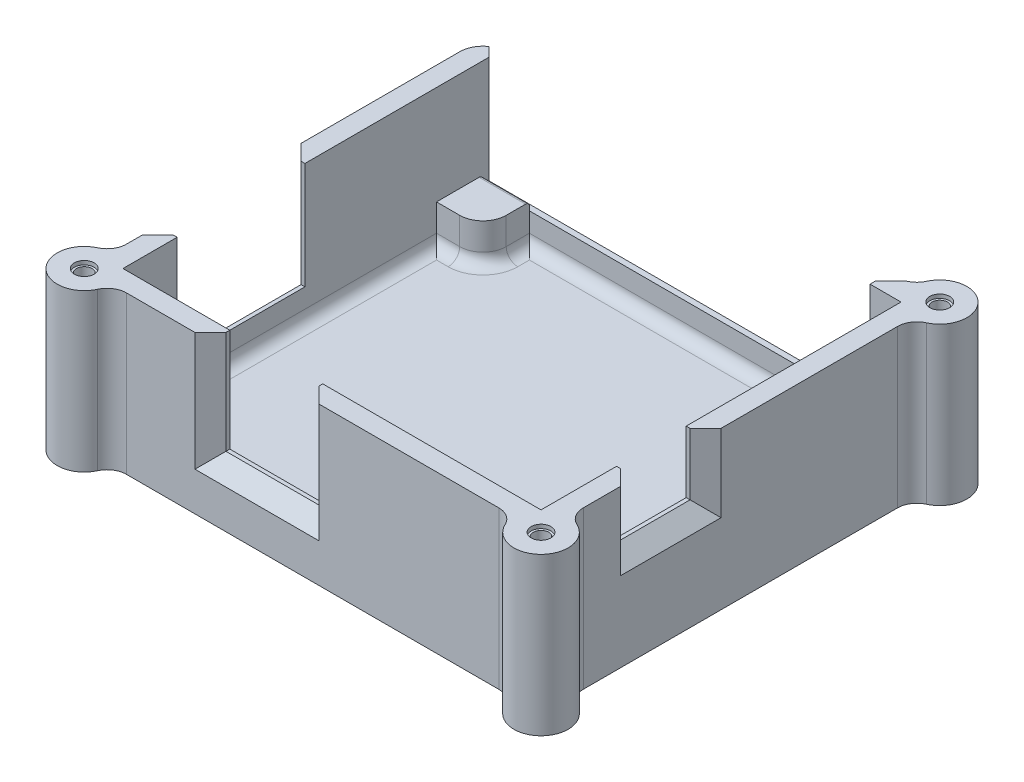
from build123d import *

# Parameters (mm, degrees)
SKETCH1_W               = 118
SKETCH1_H               = 103
SKETCH1_W_2             = 108
SKETCH1_H_2             = 93
SKETCH1_W_3             = 106
SKETCH1_H_3             = 91
BOSS_EXTRUDE1_DEPTH     = 5
SKETCH2_W               = 118
SKETCH2_H               = 103
SKETCH2_W_2             = 108
SKETCH2_H_2             = 93
BOSS_EXTRUDE2_DEPTH     = 35.6
SKETCH3_W               = 12
SKETCH3_H               = 12
BOSS_EXTRUDE3_DEPTH     = 10
MIRROR5_COPY_1_SKETCH_W = 12
MIRROR5_COPY_1_SKETCH_H = 12
MIRROR5_COPY_1_DEPTH    = 10
SKETCH4_R               = 2
CUT_EXTRUDE1_DEPTH      = 6
SKETCH4_3_R             = 2.525
CUT_EXTRUDE2_DEPTH      = 1
SKETCH6_W               = 100
SKETCH6_H               = 27.6
CUT_EXTRUDE3_DEPTH      = 122.381052887
SKETCH7_W               = 33
SKETCH7_H               = 27.6
CUT_EXTRUDE4_DEPTH      = 131.650717564
SKETCH8_W               = 24
SKETCH8_H               = 26.6
CUT_EXTRUDE5_DEPTH      = 122.381052887
CHAMFER1_SIZE           = 3.5
SKETCH10_W              = 18
SKETCH10_H              = 16
CUT_EXTRUDE7_DEPTH      = 131.650717564
SKETCH11_R              = 7
BOSS_EXTRUDE4_DEPTH     = 40.6
FILLET1_R               = 6
CHAMFER2_SIZE           = 4
CHAMFER3_SIZE           = 4
FILLET2_R               = 3
CHAMFER4_SIZE           = 4
FILLET7_R               = 5
FILLET8_R               = 1
FILLET9_R               = 6
SKETCH12_R              = 2
CUT_EXTRUDE9_DEPTH      = 10
SKETCH12_3_R            = 2.55
CUT_EXTRUDE10_DEPTH     = 1


with BuildPart() as part:
    # Sketch1 → Boss-Extrude1 (new body)
    # profile 1 of 3: a face of its own
    with BuildSketch(Plane(origin=(0, 0, 0), x_dir=(1, 0, 0), z_dir=(0, 1, 0))):
        Rectangle(SKETCH1_W, SKETCH1_H)
        Rectangle(SKETCH1_W_2, SKETCH1_H_2, mode=Mode.SUBTRACT)
    # profile 2 of 3: a face of its own
    with BuildSketch(Plane(origin=(0, 0, 0), x_dir=(1, 0, 0), z_dir=(0, 1, 0))):
        Rectangle(SKETCH1_W_2, SKETCH1_H_2)
        Rectangle(SKETCH1_W_3, SKETCH1_H_3, mode=Mode.SUBTRACT)
    # profile 3 of 3: a face of its own
    with BuildSketch(Plane(origin=(0, 0, 0), x_dir=(1, 0, 0), z_dir=(0, 1, 0))):
        Rectangle(SKETCH1_W_3, SKETCH1_H_3)
    extrude(amount=BOSS_EXTRUDE1_DEPTH)

    # Sketch2 → Boss-Extrude2 (add)
    with BuildSketch(Plane(origin=(0, 5, 0), x_dir=(1, 0, 0), z_dir=(0, 1, 0))):
        Rectangle(SKETCH2_W, SKETCH2_H)
        Rectangle(SKETCH2_W_2, SKETCH2_H_2, mode=Mode.SUBTRACT)
    extrude(amount=BOSS_EXTRUDE2_DEPTH)

    # Sketch3 → Boss-Extrude3 (add)
    with BuildSketch(Plane(origin=(0, 5, 0), x_dir=(1, 0, 0), z_dir=(0, 1, 0))):
        with Locations((48, -40.5)):
            Rectangle(SKETCH3_W, SKETCH3_H)
    boss_extrude3 = extrude(amount=BOSS_EXTRUDE3_DEPTH)

    # Mirror4: Boss-Extrude3 across plane
    add(boss_extrude3.mirror(Plane(origin=(0, 0, 0), x_dir=(0, 0, 1), z_dir=(1, 0, 0))))

    # Mirror5: Boss-Extrude3 across plane
    add(boss_extrude3.mirror(Plane.XY))

    # Mirror5 copy 1 sketch → Mirror5 copy 1 (add)
    with BuildSketch(Plane(origin=(0, 5, 0), x_dir=(-1, 0, 0), z_dir=(0, 1, 0))):
        with Locations((48, -40.5)):
            Rectangle(MIRROR5_COPY_1_SKETCH_W, MIRROR5_COPY_1_SKETCH_H)
    extrude(amount=MIRROR5_COPY_1_DEPTH)

    # Sketch4 → Cut-Extrude1 (cut)
    with BuildSketch(Plane(origin=(0, 15, 0), x_dir=(1, 0, 0), z_dir=(0, 1, 0))):
        with Locations(Location((48, -40.5, 0), (0, 0, 270))):
            Circle(SKETCH4_R)
    cut_extrude1 = extrude(amount=-CUT_EXTRUDE1_DEPTH, mode=Mode.SUBTRACT)

    # Sketch4<3> → Cut-Extrude2 (cut)
    with BuildSketch(Plane(origin=(0, 15, 0), x_dir=(1, 0, 0), z_dir=(0, 1, 0))):
        with Locations(Location((48, -40.5, 0), (0, 0, 270))):
            Circle(SKETCH4_3_R)
    cut_extrude2 = extrude(amount=-CUT_EXTRUDE2_DEPTH, mode=Mode.SUBTRACT)

    # Mirror2: Boss-Extrude3, Cut-Extrude1, Cut-Extrude2 across plane
    add(boss_extrude3.mirror(Plane.XY))
    add(cut_extrude1.mirror(Plane.XY), mode=Mode.SUBTRACT)
    add(cut_extrude2.mirror(Plane.XY), mode=Mode.SUBTRACT)

    # Mirror2 at the second plane: Boss-Extrude3, Cut-Extrude1, Cut-Extrude2 across plane
    add(boss_extrude3.mirror(Plane(origin=(0, 0, 0), x_dir=(0, 0, 1), z_dir=(1, 0, 0))))
    add(cut_extrude1.mirror(Plane(origin=(0, 0, 0), x_dir=(0, 0, 1), z_dir=(1, 0, 0))), mode=Mode.SUBTRACT)
    add(cut_extrude2.mirror(Plane(origin=(0, 0, 0), x_dir=(0, 0, 1), z_dir=(1, 0, 0))), mode=Mode.SUBTRACT)

    # Sketch6 → Cut-Extrude3 (cut, through all)
    with BuildSketch(Plane.XY.offset(-46.5)):
        with Locations((-4, 26.8)):
            Rectangle(SKETCH6_W, SKETCH6_H)
    extrude(amount=-CUT_EXTRUDE3_DEPTH, mode=Mode.SUBTRACT)

    # Sketch7 → Cut-Extrude4 (cut, through all)
    with BuildSketch(Plane(origin=(-54, 0, 0), x_dir=(0, 0, -1), z_dir=(1, 0, 0))):
        with Locations((-16, 26.8)):
            Rectangle(SKETCH7_W, SKETCH7_H)
    extrude(amount=-CUT_EXTRUDE4_DEPTH, mode=Mode.SUBTRACT)

    # Sketch8 → Cut-Extrude5 (cut, through all)
    with BuildSketch(Plane(origin=(0, 0, 46.5), x_dir=(-1, 0, 0), z_dir=(0, 0, -1))):
        with Locations((14.4, 27.3)):
            Rectangle(SKETCH8_W, SKETCH8_H)
    extrude(amount=-CUT_EXTRUDE5_DEPTH, mode=Mode.SUBTRACT)

    # Chamfer1
    chamfer1_edges = [part.edges().sort_by_distance(p)[0] for p in [
        (-54, 26.8, -51.5),
        (46, 26.8, -51.5),
        (-4, 13, -51.5),
    ]]
    chamfer(chamfer1_edges, length=CHAMFER1_SIZE)

    # Sketch10 → Cut-Extrude7 (cut, through all)
    with BuildSketch(Plane.ZY.offset(-54)):
        with Locations((18, 32.6)):
            Rectangle(SKETCH10_W, SKETCH10_H)
    extrude(amount=-CUT_EXTRUDE7_DEPTH, mode=Mode.SUBTRACT)

    # Sketch11 → Boss-Extrude4 (add)
    with BuildSketch(Plane(origin=(0, 0, 0), x_dir=(1, 0, 0), z_dir=(0, 1, 0))):
        with Locations((59, -51.5)):
            Circle(SKETCH11_R)
        with Locations((59, 51.5)):
            Circle(SKETCH11_R)
        with Locations((-59, -51.5)):
            Circle(SKETCH11_R)
    extrude(amount=BOSS_EXTRUDE4_DEPTH)

    # Fillet1
    fillet1_edges = [part.edges().sort_by_distance(p)[0] for p in [
        (42, 10, 34.5),
        (-42, 10, 34.5),
        (-42, 10, -34.5),
        (42, 10, -34.5),
    ]]
    fillet(fillet1_edges, radius=FILLET1_R)

    # Chamfer2
    chamfer2_edges = [part.edges().sort_by_distance(p)[0] for p in [
        (-59, 26.8, 32.5),
        (-59, 26.8, -0.5),
        (-59, 13, 16),
    ]]
    chamfer(chamfer2_edges, length=CHAMFER2_SIZE)

    # Chamfer3
    chamfer3_edges = [part.edges().sort_by_distance(p)[0] for p in [
        (-26.4, 27.3, 51.5),
        (-14.4, 14, 51.5),
        (-2.4, 27.3, 51.5),
    ]]
    chamfer(chamfer3_edges, length=CHAMFER3_SIZE)

    # Fillet2
    fillet2_edges = [part.edges().sort_by_distance(p)[0] for p in [
        (-42, 5, 43.5),
        (-42, 5, -43.5),
        (42, 5, -43.5),
        (42, 5, 43.5),
        (-43.757359313, 5, 36.257359313),
        (-43.757359313, 5, -36.257359313),
        (43.757359313, 5, -36.257359313),
        (43.757359313, 5, 36.257359313),
        (54, 5, 0),
        (51, 5, 34.5),
        (0, 5, 46.5),
        (-51, 5, 34.5),
        (-54, 5, 0),
        (-51, 5, -34.5),
        (0, 5, -46.5),
        (51, 5, -34.5),
    ]]
    fillet(fillet2_edges, radius=FILLET2_R)

    # Chamfer4
    chamfer4_edges = [part.edges().sort_by_distance(p)[0] for p in [
        (59, 32.6, 9),
        (59, 32.6, 27),
        (59, 24.6, 18),
    ]]
    chamfer(chamfer4_edges, length=CHAMFER4_SIZE)

    # Fillet7
    fillet7_edges = [part.edges().sort_by_distance(p)[0] for p in [
        (52, 20.3, -51.5),
        (59, 20.3, -44.5),
        (59, 20.3, 44.5),
        (52, 20.3, 51.5),
        (-52, 20.3, 51.5),
        (-59, 20.3, 44.5),
    ]]
    fillet(fillet7_edges, radius=FILLET7_R)

    # Fillet8
    fillet8_edges = [part.edges().sort_by_distance(p)[0] for p in [
        (-48, 15, -46.5),
        (44, 15, -46.5),
    ]]
    fillet(fillet8_edges, radius=FILLET8_R)

    # Fillet9
    fillet9_edges = [part.edges().sort_by_distance(p)[0] for p in [
        (-59, 20.3, -51.5),
    ]]
    fillet(fillet9_edges, radius=FILLET9_R)

    # Sketch12 → Cut-Extrude9 (cut)
    with BuildSketch(Plane(origin=(0, 40.6, 0), x_dir=(1, 0, 0), z_dir=(0, 1, 0))):
        with Locations(Location((59, -51.5, 0), (0, 0, 270))):
            Circle(SKETCH12_R)
    cut_extrude9 = extrude(amount=-CUT_EXTRUDE9_DEPTH, mode=Mode.SUBTRACT)

    # Sketch12<3> → Cut-Extrude10 (cut)
    with BuildSketch(Plane(origin=(0, 40.6, 0), x_dir=(1, 0, 0), z_dir=(0, 1, 0))):
        with Locations(Location((59, -51.5, 0), (0, 0, 270))):
            Circle(SKETCH12_3_R)
    cut_extrude10 = extrude(amount=-CUT_EXTRUDE10_DEPTH, mode=Mode.SUBTRACT)

    # Mirror6: Cut-Extrude9, Cut-Extrude10 across plane
    add(cut_extrude9.mirror(Plane(origin=(0, 0, 0), x_dir=(0, 0, 1), z_dir=(1, 0, 0))), mode=Mode.SUBTRACT)
    add(cut_extrude10.mirror(Plane(origin=(0, 0, 0), x_dir=(0, 0, 1), z_dir=(1, 0, 0))), mode=Mode.SUBTRACT)

    # Mirror6 at the second plane: Cut-Extrude9, Cut-Extrude10 across plane
    add(cut_extrude9.mirror(Plane.XY), mode=Mode.SUBTRACT)
    add(cut_extrude10.mirror(Plane.XY), mode=Mode.SUBTRACT)


solid = part.part
